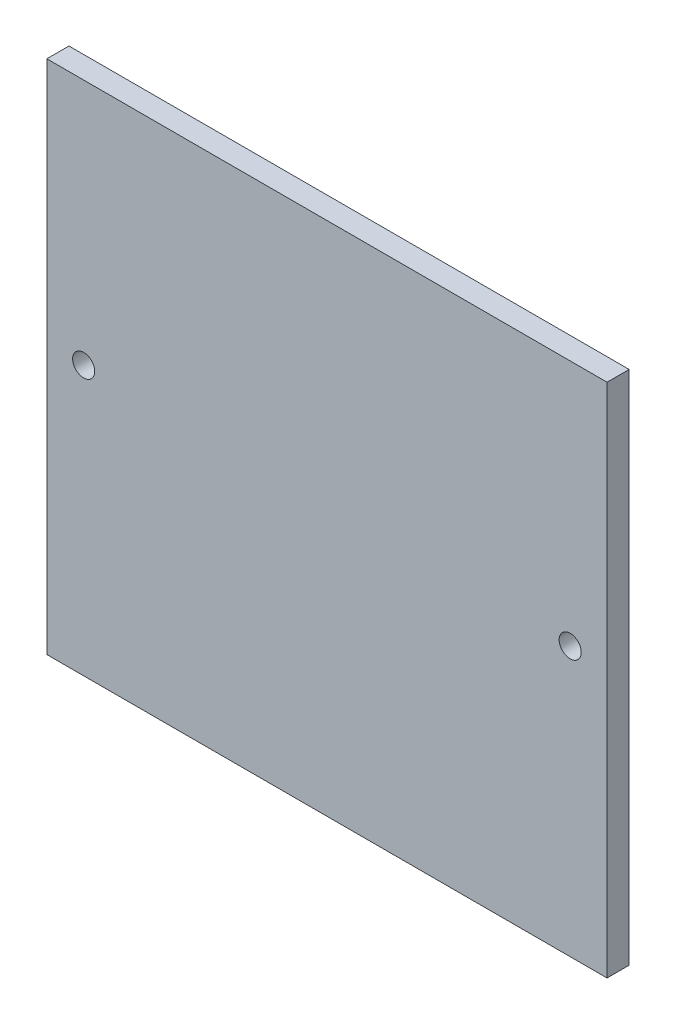
from build123d import *

# Parameters (mm, degrees)
ESQUISSE1_W        = 76
ESQUISSE1_H        = 70
ESQUISSE1_R        = 1.5
BOSS_EXTRU_1_DEPTH = 3


with BuildPart() as part:
    # Esquisse1 → Boss.-Extru.1 (new body)
    with BuildSketch(Plane.XY):
        with Locations((6.496995991, -18.275449102)):
            Rectangle(ESQUISSE1_W, ESQUISSE1_H)
        with Locations((-26.503004009, -16.775449102)):
            Circle(ESQUISSE1_R, mode=Mode.SUBTRACT)
        with Locations((39.496995991, -16.775449102)):
            Circle(ESQUISSE1_R, mode=Mode.SUBTRACT)
    extrude(amount=BOSS_EXTRU_1_DEPTH)


solid = part.part
